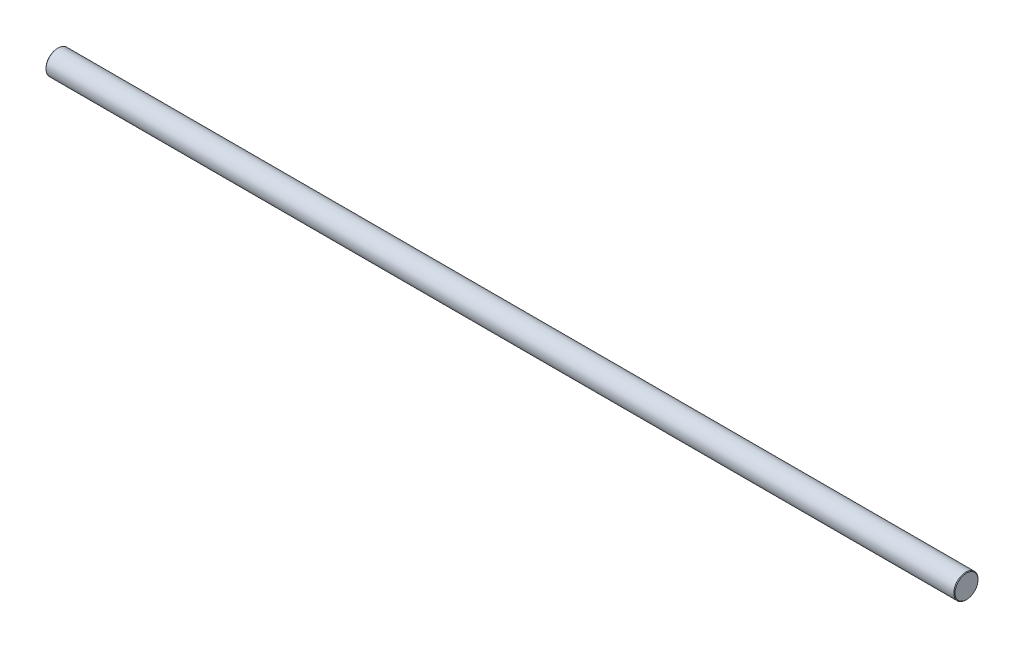
from build123d import *

# Parameters (mm, degrees)
SKETCH1_R           = 4
BOSS_EXTRUDE1_DEPTH = 300
SKETCH5_OUTSIDE_W   = 672.15
SKETCH5_OUTSIDE_H   = 672.15
SKETCH5_OUTSIDE_R   = 3.8
CUT_EXTRUDE2_DEPTH  = 301.053328593
CUT_EXTRUDE2_DRAFT  = -45
SKETCH6_OUTSIDE_W   = 672.15
SKETCH6_OUTSIDE_H   = 672.15
SKETCH6_OUTSIDE_R   = 3.8
CUT_EXTRUDE3_DEPTH  = 301.053328593
CUT_EXTRUDE3_DRAFT  = -45


with BuildPart() as part:
    # Sketch1 → Boss-Extrude1 (new body)
    with BuildSketch(Plane(origin=(0, 0, 0), x_dir=(0, 0, -1), z_dir=(1, 0, 0))):
        Circle(SKETCH1_R)
    extrude(amount=BOSS_EXTRUDE1_DEPTH)


with BuildPart() as cut_extrude2_tool:
    # Sketch5 outside → Cut-Extrude2 (with draft: the straight prism first)
    with BuildSketch(Plane.ZY):
        Rectangle(SKETCH5_OUTSIDE_W, SKETCH5_OUTSIDE_H)
        Circle(SKETCH5_OUTSIDE_R, mode=Mode.SUBTRACT)
    extrude(amount=-CUT_EXTRUDE2_DEPTH)
    # Cut-Extrude2: the draft: its side faces are tilted about the plane it starts from
    cut_extrude2_sides = [cut_extrude2_tool.faces().sort_by_distance(p)[0] for p in [
        (150.526664297, -336.075, 0),
        (150.526664297, 0, 336.075),
        (150.526664297, 336.075, 0),
        (150.526664297, 0, -336.075),
        (150.526664297, 0, -3.8),
    ]]
    draft(cut_extrude2_sides, Plane.ZY, CUT_EXTRUDE2_DRAFT)


with BuildPart() as part_1:
    add(part.part)

    # Cut-Extrude2: cut by cut_extrude2_tool
    add(cut_extrude2_tool.part, mode=Mode.SUBTRACT)


with BuildPart() as cut_extrude3_tool:
    # Sketch6 outside → Cut-Extrude3 (with draft: the straight prism first)
    with BuildSketch(Plane(origin=(300, 0, 0), x_dir=(0, 0, -1), z_dir=(1, 0, 0))):
        Rectangle(SKETCH6_OUTSIDE_W, SKETCH6_OUTSIDE_H)
        Circle(SKETCH6_OUTSIDE_R, mode=Mode.SUBTRACT)
    extrude(amount=-CUT_EXTRUDE3_DEPTH)
    # Cut-Extrude3: the draft: its side faces are tilted about the plane it starts from
    cut_extrude3_sides = [cut_extrude3_tool.faces().sort_by_distance(p)[0] for p in [
        (149.473335703, -336.075, 0),
        (149.473335703, 0, -336.075),
        (149.473335703, 336.075, 0),
        (149.473335703, 0, 336.075),
        (149.473335703, 0, 3.8),
    ]]
    draft(cut_extrude3_sides, Plane(origin=(300, 0, 0), x_dir=(0, 0, -1), z_dir=(1, 0, 0)), CUT_EXTRUDE3_DRAFT)


with BuildPart() as part_2:
    add(part_1.part)

    # Cut-Extrude3: cut by cut_extrude3_tool
    add(cut_extrude3_tool.part, mode=Mode.SUBTRACT)


solid = part_2.part
